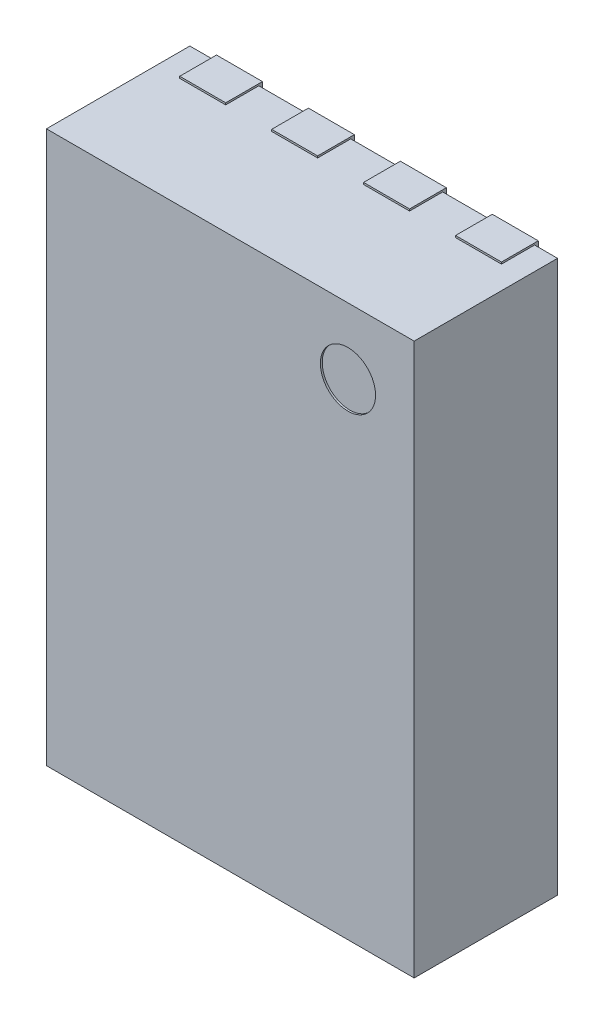
from build123d import *

# Parameters (mm, degrees)
SKETCH1_W            = 2
SKETCH1_H            = 3
BOSS_EXTRUDE1_DEPTH  = 0.78
SKETCH2_R            = 0.15
CUT_EXTRUDE1_DEPTH   = 0.01
BOSS_EXTRUDE2_DEPTH  = 0.02
BOSS_EXTRUDE4_START  = -0.18
BOSS_EXTRUDE4_DEPTH  = 0.2
LPATTERN2_COUNT      = 4
LPATTERN2_PITCH      = 0.5
MIRROR2_START        = -0.18
MIRROR2_COPY_1_DEPTH = 0.2
MIRROR2_COPY_2_DEPTH = 0.2
MIRROR2_COPY_3_DEPTH = 0.2
CUT_EXTRUDE2_DEPTH   = 0.02


with BuildPart() as part:
    # Sketch1 → Boss-Extrude1 (new body)
    with BuildSketch(Plane.XY):
        Rectangle(SKETCH1_W, SKETCH1_H)
    extrude(amount=BOSS_EXTRUDE1_DEPTH)

    # Sketch2 → Cut-Extrude1 (cut)
    with BuildSketch(Plane.XY.offset(0.78)):
        with Locations((0.64, 1.14)):
            Circle(SKETCH2_R)
    extrude(amount=-CUT_EXTRUDE1_DEPTH, mode=Mode.SUBTRACT)

    # Sketch3 → Boss-Extrude2 (add)
    with BuildSketch(Plane(origin=(0, 0, 0), x_dir=(-1, 0, 0), z_dir=(0, 0, -1))):
        with BuildLine():
            Line((0.735, -0.75), (-0.735, -0.75))
            ThreePointArc((-0.735, -0.75), (-0.745606602, -0.745606602), (-0.75, -0.735))
            Line((-0.75, -0.735), (-0.75, 0.735))
            ThreePointArc((-0.75, 0.735), (-0.745606602, 0.745606602), (-0.735, 0.75))
            Line((-0.735, 0.75), (0.735, 0.75))
            ThreePointArc((0.735, 0.75), (0.745606602, 0.745606602), (0.75, 0.735))
            Line((0.75, 0.735), (0.75, -0.735))
            ThreePointArc((0.75, -0.735), (0.745606602, -0.745606602), (0.735, -0.75))
        make_face()
    extrude(amount=BOSS_EXTRUDE2_DEPTH)

    # Sketch6 → Boss-Extrude4 (add)
    with BuildSketch(Plane(origin=(0, 0, 0), x_dir=(-1, 0, 0), z_dir=(0, 0, -1)).offset(BOSS_EXTRUDE4_START)):
        with BuildLine():
            Line((-0.875, 1.51), (-0.625, 1.51))
            Line((-0.625, 1.51), (-0.625, 1.5))
            Line((-0.625, 1.5), (-0.625, 1.225))
            ThreePointArc((-0.625, 1.225), (-0.75, 1.1), (-0.875, 1.225))
            Line((-0.875, 1.225), (-0.875, 1.5))
            Line((-0.875, 1.5), (-0.875, 1.51))
        make_face()
    boss_extrude4 = extrude(amount=BOSS_EXTRUDE4_DEPTH)

    # LPattern2: Boss-Extrude4 ×4
    with Locations(*[(-i * LPATTERN2_PITCH, 0, 0) for i in range(1, LPATTERN2_COUNT)]):
        add(boss_extrude4)

    # Mirror2: Boss-Extrude4 across plane
    add(boss_extrude4.mirror(Plane.ZX))

    # Mirror2 copy 1 sketch → Mirror2 copy 1 (add)
    with BuildSketch(Plane(origin=(-0.5, 0, 0), x_dir=(-1, 0, 0), z_dir=(0, 0, -1)).offset(MIRROR2_START)):
        with BuildLine():
            Line((-0.875, -1.51), (-0.625, -1.51))
            Line((-0.625, -1.51), (-0.625, -1.5))
            Line((-0.625, -1.5), (-0.625, -1.225))
            ThreePointArc((-0.625, -1.225), (-0.75, -1.1), (-0.875, -1.225))
            Line((-0.875, -1.225), (-0.875, -1.5))
            Line((-0.875, -1.5), (-0.875, -1.51))
        make_face()
    extrude(amount=MIRROR2_COPY_1_DEPTH)

    # Mirror2 copy 2 sketch → Mirror2 copy 2 (add)
    with BuildSketch(Plane(origin=(-1, 0, 0), x_dir=(-1, 0, 0), z_dir=(0, 0, -1)).offset(MIRROR2_START)):
        with BuildLine():
            Line((-0.875, -1.51), (-0.625, -1.51))
            Line((-0.625, -1.51), (-0.625, -1.5))
            Line((-0.625, -1.5), (-0.625, -1.225))
            ThreePointArc((-0.625, -1.225), (-0.75, -1.1), (-0.875, -1.225))
            Line((-0.875, -1.225), (-0.875, -1.5))
            Line((-0.875, -1.5), (-0.875, -1.51))
        make_face()
    extrude(amount=MIRROR2_COPY_2_DEPTH)

    # Mirror2 copy 3 sketch → Mirror2 copy 3 (add)
    with BuildSketch(Plane(origin=(-1.5, 0, 0), x_dir=(-1, 0, 0), z_dir=(0, 0, -1)).offset(MIRROR2_START)):
        with BuildLine():
            Line((-0.875, -1.51), (-0.625, -1.51))
            Line((-0.625, -1.51), (-0.625, -1.5))
            Line((-0.625, -1.5), (-0.625, -1.225))
            ThreePointArc((-0.625, -1.225), (-0.75, -1.1), (-0.875, -1.225))
            Line((-0.875, -1.225), (-0.875, -1.5))
            Line((-0.875, -1.5), (-0.875, -1.51))
        make_face()
    extrude(amount=MIRROR2_COPY_3_DEPTH)

    # Sketch7 → Cut-Extrude2 (cut)
    with BuildSketch(Plane(origin=(0, 0, -0.02), x_dir=(-1, 0, 0), z_dir=(0, 0, -1))):
        Polygon((-0.75, 0.467157288), (-0.467157288, 0.75), (-0.75, 0.75), align=None)
    extrude(amount=-CUT_EXTRUDE2_DEPTH, mode=Mode.SUBTRACT)


solid = part.part
